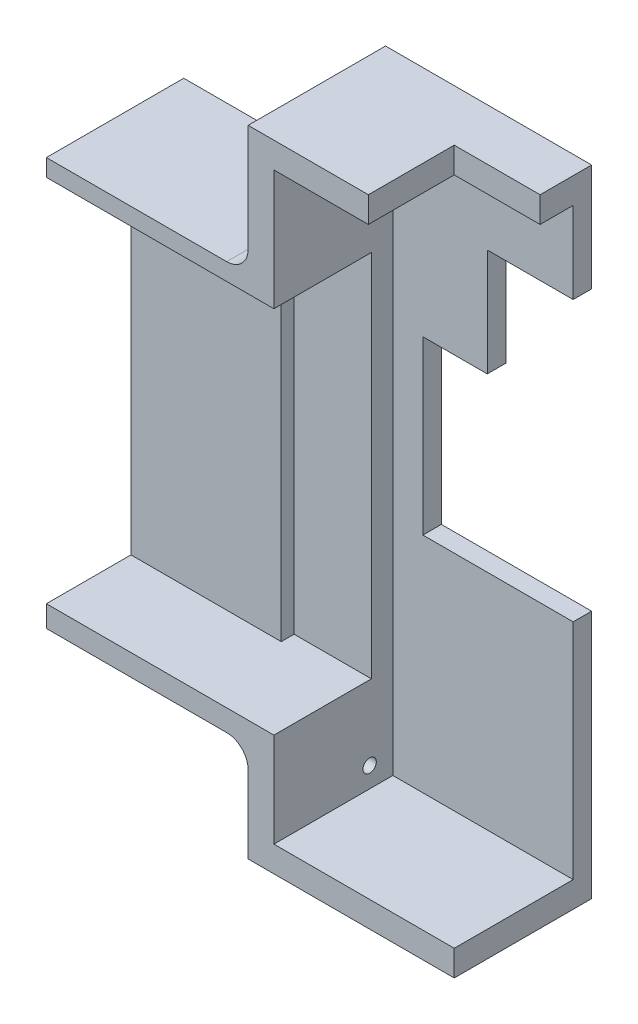
from build123d import *

# Parameters (mm, degrees)
SKETCH_1_W           = 130
SKETCH_1_H           = 64
EXTRUDE_1_DEPTH      = 125
SKETCH_2_W           = 55.4
SKETCH_2_H           = 114
CUT_EXTRUDE_1_DEPTH  = 47
SKETCH_3_W           = 45.4
SKETCH_3_H           = 86
CUT_EXTRUDE_2_DEPTH  = 78
SKETCH_4_W           = 24.038907643
SKETCH_4_H           = 40
CUT_EXTRUDE_3_DEPTH  = 40
SKETCH_5_W           = 4.3
SKETCH_5_H           = 25
CUT_EXTRUDE_4_DEPTH  = 25
SKETCH_6_W           = 10
SKETCH_6_H           = 40
CUT_EXTRUDE_5_DEPTH  = 25
SKETCH_9_W           = 5
SKETCH_9_H           = 125
CUT_EXTRUDE_8_DEPTH  = 155.744951452
SKETCH_12_W          = 32
SKETCH_12_H          = 30
CUT_EXTRUDE_10_DEPTH = 155.744951452
SKETCH_13_W          = 45
SKETCH_13_H          = 64
CUT_EXTRUDE_11_DEPTH = 30
SKETCH_14_W          = 32
SKETCH_14_H          = 157.482614071
CUT_EXTRUDE_12_DEPTH = 180.649659059
SKETCH_18_W          = 30
SKETCH_18_H          = 95
CUT_EXTRUDE_15_DEPTH = 145.478372084
SKETCH_19_W          = 35
SKETCH_19_H          = 86
EXTRUDE_4_DEPTH      = 3
SKETCH_20_W          = 20
SKETCH_20_H          = 6
CUT_EXTRUDE_16_DEPTH = 150.244765402
FILLET_1_R           = 5
SKETCH_21_W          = 42
SKETCH_21_H          = 27.7
CUT_EXTRUDE_17_DEPTH = 138.927517197
EXTRUDE_7_DEPTH      = 27.7
SKETCH_23_W          = 48
SKETCH_23_H          = 4.3
EXTRUDE_8_DEPTH      = 23
SKETCH_25_R          = 1.55
CUT_EXTRUDE_19_DEPTH = 138.669895039
FILLET_3_R           = 5


with BuildPart() as part:
    # 草图1 → 凸台-拉伸1 (new body)
    with BuildSketch(Plane(origin=(0, 0, 0), x_dir=(1, 0, 0), z_dir=(0, 1, 0))):
        Rectangle(SKETCH_1_W, SKETCH_1_H)
    extrude(amount=EXTRUDE_1_DEPTH)

    # 草图2 → 切除-拉伸1 (cut)
    with BuildSketch(Plane(origin=(65, 0, 0), x_dir=(0, 0, -1), z_dir=(1, 0, 0))):
        with Locations((0, 62)):
            Rectangle(SKETCH_2_W, SKETCH_2_H)
    extrude(amount=-CUT_EXTRUDE_1_DEPTH, mode=Mode.SUBTRACT)

    # 草图3 → 切除-拉伸2 (cut)
    with BuildSketch(Plane(origin=(18, 0, 0), x_dir=(0, 0, -1), z_dir=(1, 0, 0))):
        with Locations((0, 48)):
            Rectangle(SKETCH_3_W, SKETCH_3_H)
    extrude(amount=-CUT_EXTRUDE_2_DEPTH, mode=Mode.SUBTRACT)

    # 草图4 → 切除-拉伸3 (cut)
    with BuildSketch(Plane(origin=(65, 0, 0), x_dir=(0, 0, -1), z_dir=(1, 0, 0))):
        with Locations((26.569318974, 55)):
            Rectangle(SKETCH_4_W, SKETCH_4_H)
    extrude(amount=-CUT_EXTRUDE_3_DEPTH, mode=Mode.SUBTRACT)

    # 草图5 → 切除-拉伸4 (cut)
    with BuildSketch(Plane(origin=(65, 0, 0), x_dir=(0, 0, -1), z_dir=(1, 0, 0))):
        with Locations((29.85, 87.5)):
            Rectangle(SKETCH_5_W, SKETCH_5_H)
    extrude(amount=-CUT_EXTRUDE_4_DEPTH, mode=Mode.SUBTRACT)

    # 草图6 → 切除-拉伸5 (cut)
    with BuildSketch(Plane(origin=(0, 125, 0), x_dir=(1, 0, 0), z_dir=(0, 1, 0))):
        with Locations((45, 0)):
            Rectangle(SKETCH_6_W, SKETCH_6_H)
    extrude(amount=-CUT_EXTRUDE_5_DEPTH, mode=Mode.SUBTRACT)

    # 草图9 → 切除-拉伸8 (cut, through all)
    with BuildSketch(Plane.XY.offset(32)):
        with Locations((62.5, 62.5)):
            Rectangle(SKETCH_9_W, SKETCH_9_H)
    extrude(amount=-CUT_EXTRUDE_8_DEPTH, mode=Mode.SUBTRACT)

    # 草图12 → 切除-拉伸10 (cut, through all)
    with BuildSketch(Plane.XY.offset(32)):
        with Locations((-49, 110)):
            Rectangle(SKETCH_12_W, SKETCH_12_H)
    extrude(amount=-CUT_EXTRUDE_10_DEPTH, mode=Mode.SUBTRACT)

    # 草图13 → 切除-拉伸11 (cut)
    with BuildSketch(Plane(origin=(0, 125, 0), x_dir=(1, 0, 0), z_dir=(0, 1, 0))):
        with Locations((-10.5, 0)):
            Rectangle(SKETCH_13_W, SKETCH_13_H)
    extrude(amount=-CUT_EXTRUDE_11_DEPTH, mode=Mode.SUBTRACT)

    # 草图14 → 切除-拉伸12 (cut, through all)
    with BuildSketch(Plane.ZY.offset(65)):
        with Locations((16, 78.741307036)):
            Rectangle(SKETCH_14_W, SKETCH_14_H)
    extrude(amount=-CUT_EXTRUDE_12_DEPTH, mode=Mode.SUBTRACT)

    # 草图18 → 切除-拉伸15 (cut, through all)
    with BuildSketch(Plane.XY):
        with Locations((-50, 47.5)):
            Rectangle(SKETCH_18_W, SKETCH_18_H)
    extrude(amount=-CUT_EXTRUDE_15_DEPTH, mode=Mode.SUBTRACT)

    # 草图19 → 凸台-拉伸4 (add)
    with BuildSketch(Plane.XY.offset(-22.7)):
        with Locations((-17.5, 48)):
            Rectangle(SKETCH_19_W, SKETCH_19_H)
    extrude(amount=EXTRUDE_4_DEPTH)

    # 草图20 → 切除-拉伸16 (cut, through all)
    with BuildSketch(Plane(origin=(40, 0, 0), x_dir=(0, 0, -1), z_dir=(1, 0, 0))):
        with Locations((10, 122)):
            Rectangle(SKETCH_20_W, SKETCH_20_H)
    extrude(amount=CUT_EXTRUDE_16_DEPTH, mode=Mode.SUBTRACT)

    # 圆角1
    fillet_1_edges = [part.edges().sort_by_distance(p)[0] for p in [
        (12, 95, -16),
    ]]
    fillet(fillet_1_edges, radius=FILLET_1_R)

    # 草图21 → 切除-拉伸17 (cut, through all)
    with BuildSketch(Plane(origin=(0, 5, 0), x_dir=(1, 0, 0), z_dir=(0, 1, 0))):
        with Locations((39, 13.85)):
            Rectangle(SKETCH_21_W, SKETCH_21_H)
    extrude(amount=-CUT_EXTRUDE_17_DEPTH, mode=Mode.SUBTRACT)

    # 草图22 → 凸台-拉伸7 (add)
    with BuildSketch(Plane.XY):
        Polygon((12, 0), (18, 0), (18, -17), (60, -17), (60, -23), (12, -23), align=None)
    extrude(amount=-EXTRUDE_7_DEPTH)

    # 草图23 → 凸台-拉伸8 (add)
    with BuildSketch(Plane.XZ):
        with Locations((36, -29.85)):
            Rectangle(SKETCH_23_W, SKETCH_23_H)
    extrude(amount=EXTRUDE_8_DEPTH)

    # 草图25 → 切除-拉伸19 (cut, through all)
    with BuildSketch(Plane.ZY.offset(-12)):
        with Locations(Location((-22.3, 113.3, 0), (0, 0, 270))):
            Circle(SKETCH_25_R)
        with Locations(Location((-22.3, -12.3, 0), (0, 0, 270))):
            Circle(SKETCH_25_R)
    extrude(amount=-CUT_EXTRUDE_19_DEPTH, mode=Mode.SUBTRACT)

    # 圆角3
    fillet_3_edges = [part.edges().sort_by_distance(p)[0] for p in [
        (12, 0, -16),
    ]]
    fillet(fillet_3_edges, radius=FILLET_3_R)


solid = part.part
